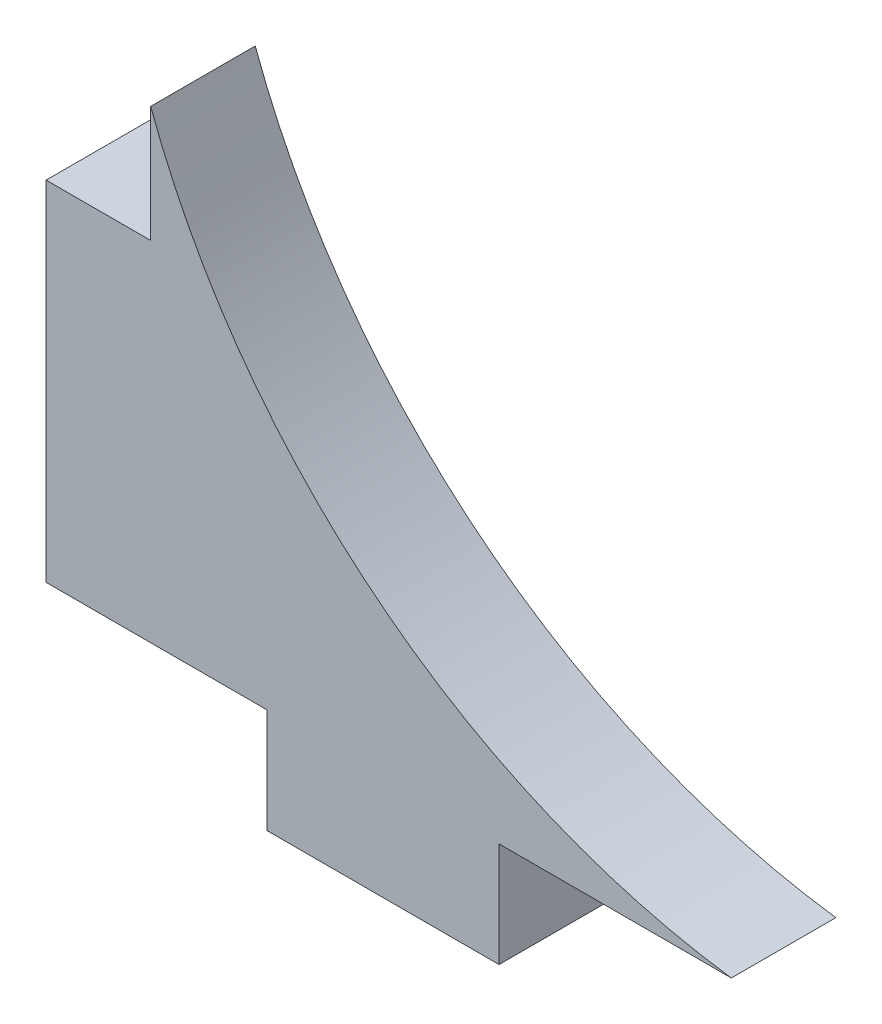
from build123d import *

# Parameters (mm, degrees)
BOSS_EXTRUDE1_DEPTH = 9


with BuildPart() as part:
    # Model → Boss-Extrude1 (new body)
    with BuildSketch(Plane.XY):
        with BuildLine():
            Line((-10, 9), (-29, 9))
            Line((-29, 9), (-29, 39))
            Line((-29, 39), (-20, 39))
            Line((-20, 39), (-20, 49))
            ThreePointArc((-20, 49), (-0.546659268, 22.066675915), (30, 9))
            Line((30, 9), (10, 9))
            Line((10, 9), (10, 0))
            Line((10, 0), (-10, 0))
            Line((-10, 0), (-10, 9))
        make_face()
    extrude(amount=BOSS_EXTRUDE1_DEPTH)


solid = part.part
